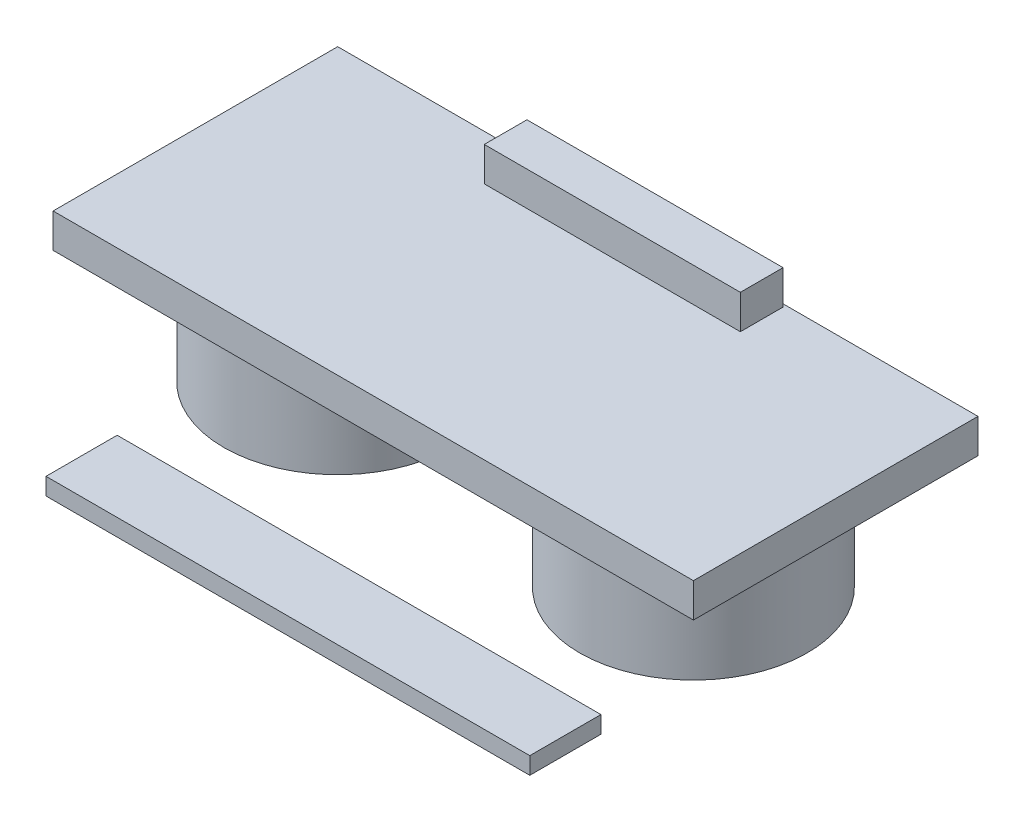
from build123d import *

# Parameters (mm, degrees)
HC_SR04_START                                = -10
SKETCH_1_W                                   = 45
SKETCH_1_H                                   = 2.4
HC_SR04_PCB_45_X_20_MM_DEPTH                 = 20
LEFT_START                                   = -9.2
SKETCH_2_R                                   = 8
LEFT_ULTRASONIC_TRANSDUCER_EYE_DIA_16_DEPTH  = 8
RIGHT_START                                  = -9.2
SKETCH_3_R                                   = 8
RIGHT_ULTRASONIC_TRANSDUCER_EYE_DIA_16_DEPTH = 8
F_4_START                                    = -9.8
SKETCH_4_W                                   = 18
SKETCH_4_H                                   = 3.2
F_4_PIN_HEADER_BLOCK_DEPTH                   = 3
SENSOR_START                                 = 11
SKETCH_5_W                                   = 34
SKETCH_5_H                                   = 1.2
SENSOR_LABEL_PLATE_HC_SR04_45X20_DEPTH       = 5


with BuildPart() as part:
    # 草图1 → HC-SR04 PCB - 45 x 20 mm (new body)
    with BuildSketch(Plane.XY.offset(HC_SR04_START)):
        Rectangle(SKETCH_1_W, SKETCH_1_H)
    extrude(amount=HC_SR04_PCB_45_X_20_MM_DEPTH)


with BuildPart() as body_2:
    # 草图2 → left ultrasonic transducer eye - dia 16 mm (new body)
    with BuildSketch(Plane(origin=(0, 0, 0), x_dir=(1, 0, 0), z_dir=(0, 1, 0)).offset(LEFT_START)):
        with Locations(Location((-12.5, 0, 0), (0, 0, 270))):
            Circle(SKETCH_2_R)
    extrude(amount=LEFT_ULTRASONIC_TRANSDUCER_EYE_DIA_16_DEPTH)


with BuildPart() as body_3:
    # 草图3 → right ultrasonic transducer eye - dia 16 mm (new body)
    with BuildSketch(Plane(origin=(0, 0, 0), x_dir=(1, 0, 0), z_dir=(0, 1, 0)).offset(RIGHT_START)):
        with Locations(Location((12.5, 0, 0), (0, 0, 270))):
            Circle(SKETCH_3_R)
    extrude(amount=RIGHT_ULTRASONIC_TRANSDUCER_EYE_DIA_16_DEPTH)


with BuildPart() as body_4:
    # 草图4 → 4 pin header block (new body)
    with BuildSketch(Plane.XY.offset(F_4_START)):
        with Locations((0, 2)):
            Rectangle(SKETCH_4_W, SKETCH_4_H)
    extrude(amount=F_4_PIN_HEADER_BLOCK_DEPTH)


with BuildPart() as body_5:
    # 草图5 → sensor label plate - HC-SR04 45x20 (new body)
    with BuildSketch(Plane.XY.offset(SENSOR_START)):
        with Locations((0, -9.8)):
            Rectangle(SKETCH_5_W, SKETCH_5_H)
    extrude(amount=SENSOR_LABEL_PLATE_HC_SR04_45X20_DEPTH)


solid = Compound([part.part, body_2.part, body_3.part, body_4.part, body_5.part])
